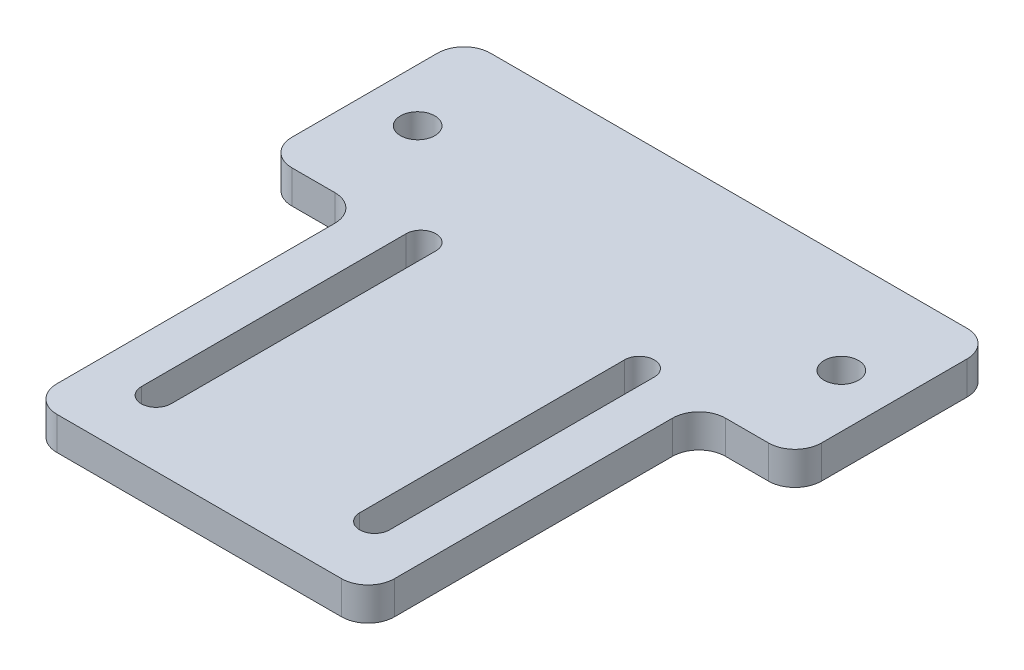
from build123d import *

# Parameters (mm, degrees)
SKETCH_1_R      = 2.6
EXTRUDE_1_DEPTH = 5
FILLET_1_R      = 4


with BuildPart() as part:
    # 草图1 → 凸台-拉伸1 (new body)
    with BuildSketch(Plane(origin=(0, 0, 0), x_dir=(1, 0, 0), z_dir=(0, 1, 0))):
        Polygon((-40, 0), (-25.5, 0), (-25.5, -50), (25.5, -50), (25.5, 0), (40, 0), (40, 30), (-40, 30), align=None)
        with Locations(Location((-32, 15, 0), (0, 0, 270))):
            Circle(SKETCH_1_R, mode=Mode.SUBTRACT)
        with Locations(Location((32, 15, 0), (0, 0, 90))):
            Circle(SKETCH_1_R, mode=Mode.SUBTRACT)
        with BuildLine():
            Line((18.75, 0), (18.75, -40))
            ThreePointArc((18.75, -40), (16.5, -42.25), (14.25, -40))
            Line((14.25, -40), (14.25, 0))
            ThreePointArc((14.25, 0), (16.5, 2.25), (18.75, 0))
        make_face(mode=Mode.SUBTRACT)
        with BuildLine():
            Line((-18.75, 0), (-18.75, -40))
            ThreePointArc((-18.75, -40), (-16.5, -42.25), (-14.25, -40))
            Line((-14.25, -40), (-14.25, 0))
            ThreePointArc((-14.25, 0), (-16.5, 2.25), (-18.75, 0))
        make_face(mode=Mode.SUBTRACT)
    extrude(amount=EXTRUDE_1_DEPTH)

    # 圆角1
    fillet_1_edges = [part.edges().sort_by_distance(p)[0] for p in [
        (-40, 2.5, -30),
        (40, 2.5, -30),
        (40, 2.5, 0),
        (25.5, 2.5, 0),
        (25.5, 2.5, 50),
        (-25.5, 2.5, 50),
        (-25.5, 2.5, 0),
        (-40, 2.5, 0),
    ]]
    fillet(fillet_1_edges, radius=FILLET_1_R)


solid = part.part
